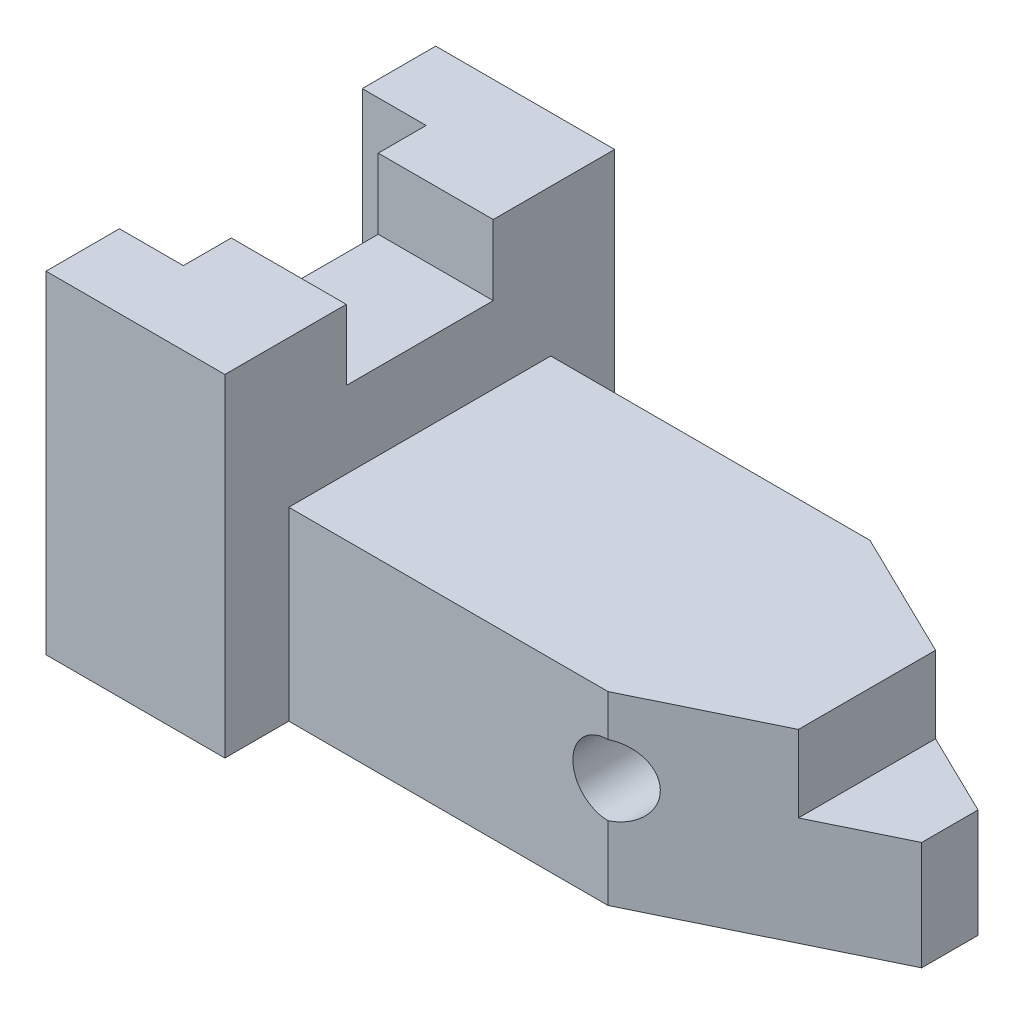
from build123d import *

# Parameters (mm, degrees)
BOSS_EXTRUDE1_DEPTH = 1320.8
BOSS_EXTRUDE2_DEPTH = 736.6
SKETCH2_W           = 584.2
SKETCH2_H           = 279.4
CUT_EXTRUDE1_DEPTH  = 736.6
SKETCH3_W           = 745.502408031
SKETCH3_H           = 618.456083572
CUT_EXTRUDE2_DEPTH  = 3372.515688067
SKETCH4_R           = 139.7
CUT_EXTRUDE3_DEPTH  = 3372.515688067


with BuildPart() as part:
    # Sketch1 → Boss-Extrude1 (new body)
    with BuildSketch(Plane(origin=(0, 0, 0), x_dir=(1, 0, 0), z_dir=(0, 1, 0))):
        Polygon((254, 0), (711.2, 0), (711.2, 520.7), (711.2, 774.7), (0, 774.7), (0, 482.6), (254, 482.6), (254, 292.1), align=None)
    boss_extrude1 = extrude(amount=BOSS_EXTRUDE1_DEPTH)

    # Sketch1<3> → Boss-Extrude2 (add)
    with BuildSketch(Plane(origin=(0, 0, 0), x_dir=(1, 0, 0), z_dir=(0, 1, 0))):
        Polygon((2818.60678969, 0), (2818.60678969, 111.882544264), (1980.40678969, 520.7), (711.2, 520.7), (711.2, 0), align=None)
    boss_extrude2 = extrude(amount=BOSS_EXTRUDE2_DEPTH)

    # Mirror2: Boss-Extrude1, Boss-Extrude2 across plane
    add(boss_extrude1.mirror(Plane(origin=(0, 1320.8, 0), x_dir=(1, 0, 0), z_dir=(0, 0, -1))))
    add(boss_extrude2.mirror(Plane(origin=(0, 1320.8, 0), x_dir=(1, 0, 0), z_dir=(0, 0, -1))))

    # Sketch2 → Cut-Extrude1 (cut)
    with BuildSketch(Plane(origin=(711.2, 0, 0), x_dir=(0, 0, -1), z_dir=(1, 0, 0))):
        with Locations((0, 1181.1)):
            Rectangle(SKETCH2_W, SKETCH2_H)
    extrude(amount=-CUT_EXTRUDE1_DEPTH, mode=Mode.SUBTRACT)

    # Sketch3 → Cut-Extrude2 (cut, through all)
    with BuildSketch(Plane.XY.offset(520.7)):
        with Locations((2861.951204016, 741.028041786)):
            Rectangle(SKETCH3_W, SKETCH3_H)
    extrude(amount=-CUT_EXTRUDE2_DEPTH, mode=Mode.SUBTRACT)

    # Sketch4 → Cut-Extrude3 (cut, through all)
    with BuildSketch(Plane.XY.offset(520.7)):
        with Locations((1980.40678969, 431.8)):
            Circle(SKETCH4_R)
    extrude(amount=-CUT_EXTRUDE3_DEPTH, mode=Mode.SUBTRACT)


solid = part.part
